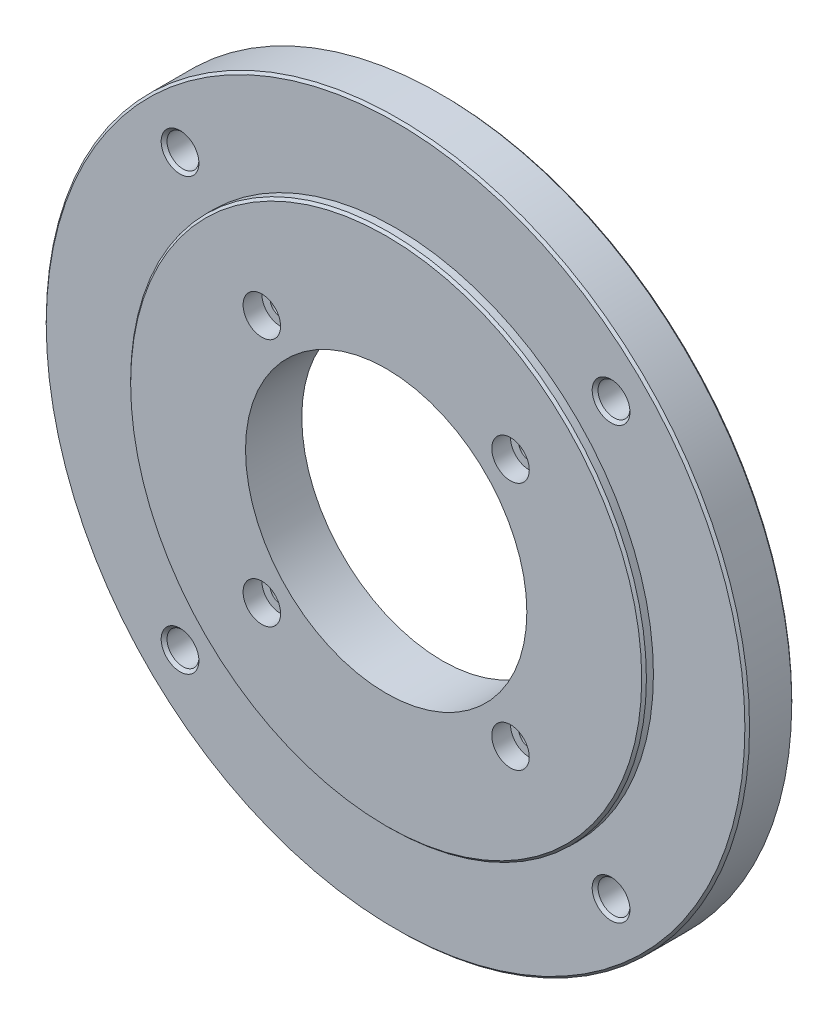
from build123d import *

# Parameters (mm, degrees)
SKETCH1_R                        = 75
BOSS_EXTRUDE1_DEPTH              = 10
SKETCH2_R                        = 55
BOSS_EXTRUDE2_DEPTH              = 2
M8X1_25_TAPPED_HOLE1_D           = 6.8
M8X1_25_TAPPED_HOLE1_CSINK_D     = 8.05
M8X1_25_TAPPED_HOLE1_CSINK_ANGLE = 90
CHAMFER1_SIZE                    = 0.5
SKETCH5_R                        = 30
CUT_EXTRUDE1_DEPTH               = 107.742681248
CBORE_FOR_M4_SHCS1_D             = 4.5
CBORE_FOR_M4_SHCS1_CBORE_D       = 8
CBORE_FOR_M4_SHCS1_CBORE_DEPTH   = 4


with BuildPart() as part:
    # Sketch1 → Boss-Extrude1 (new body)
    with BuildSketch(Plane.XY):
        Circle(SKETCH1_R)
    extrude(amount=BOSS_EXTRUDE1_DEPTH)

    # Sketch2 → Boss-Extrude2 (add)
    with BuildSketch(Plane.XY.offset(10)):
        Circle(SKETCH2_R)
    extrude(amount=BOSS_EXTRUDE2_DEPTH)

    # M8x1.25 Tapped Hole1 (through all)
    with Locations(Plane(origin=(-45.961940777, 45.961940777, 10), x_dir=(1, 0, 0), z_dir=(0, 0, 1))):
        with Locations((0, 0), (91.923881554, 0), (0, -91.923881554), (91.923881554, -91.923881554)):
            CounterSinkHole(M8X1_25_TAPPED_HOLE1_D / 2, M8X1_25_TAPPED_HOLE1_CSINK_D / 2, counter_sink_angle=M8X1_25_TAPPED_HOLE1_CSINK_ANGLE)

    # Chamfer1
    chamfer1_edges = [part.edges().sort_by_distance(p)[0] for p in [
        (-75, 0, 0),
        (-75, 0, 10),
        (-55, 0, 12),
    ]]
    chamfer(chamfer1_edges, length=CHAMFER1_SIZE)

    # Sketch5 → Cut-Extrude1 (cut, through all)
    with BuildSketch(Plane(origin=(0, 0, 0), x_dir=(-1, 0, 0), z_dir=(0, 0, -1))):
        Circle(SKETCH5_R)
    extrude(amount=-CUT_EXTRUDE1_DEPTH, mode=Mode.SUBTRACT)

    # CBORE for M4 SHCS1 (through all)
    with Locations(Plane(origin=(-26.516504294, 26.516504294, 12), x_dir=(1, 0, 0), z_dir=(0, 0, 1))):
        with Locations((0, 0), (53.033008588, 0), (0, -53.033008588), (53.033008588, -53.033008588)):
            CounterBoreHole(CBORE_FOR_M4_SHCS1_D / 2, CBORE_FOR_M4_SHCS1_CBORE_D / 2, CBORE_FOR_M4_SHCS1_CBORE_DEPTH)


solid = part.part
